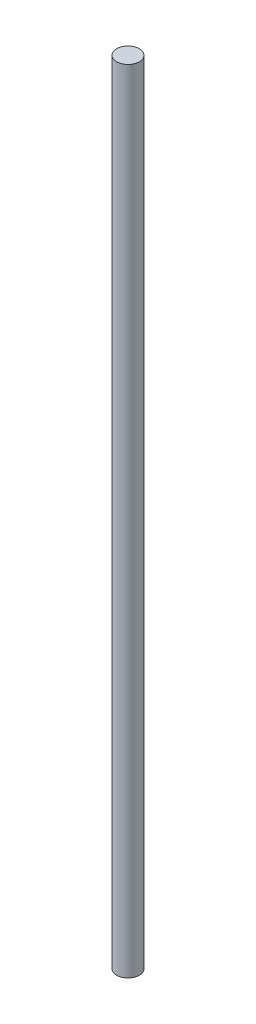
from build123d import *

# Parameters (mm, degrees)
SKETCH1_R           = 6
BOSS_EXTRUDE1_DEPTH = 420


with BuildPart() as part:
    # Sketch1 → Boss-Extrude1 (new body)
    with BuildSketch(Plane(origin=(0, 0, 0), x_dir=(1, 0, 0), z_dir=(0, 1, 0))):
        with Locations(Location((0, 0, 0), (0, 0, 270))):
            Circle(SKETCH1_R)
    extrude(amount=BOSS_EXTRUDE1_DEPTH)


solid = part.part
